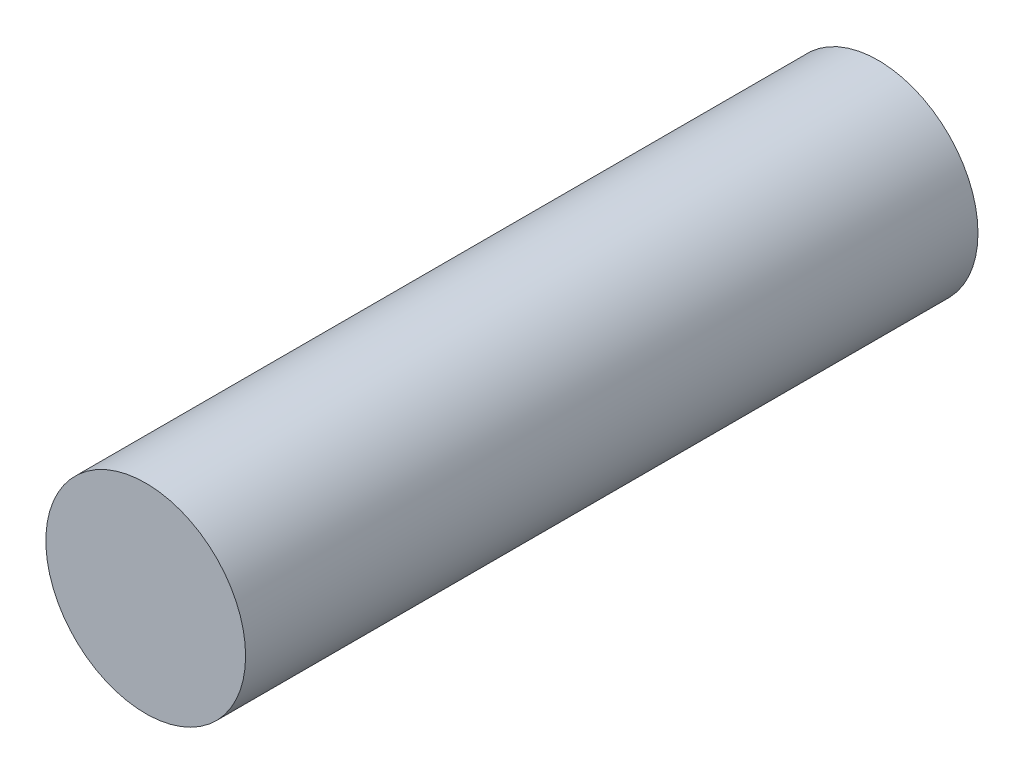
from build123d import *

# Parameters (mm, degrees)
CROQUIS1_R              = 9
SALIENTE_EXTRUIR1_DEPTH = 66


with BuildPart() as part:
    # Croquis1 → Saliente-Extruir1 (new body)
    with BuildSketch(Plane.XY):
        Circle(CROQUIS1_R)
    extrude(amount=SALIENTE_EXTRUIR1_DEPTH)


solid = part.part
